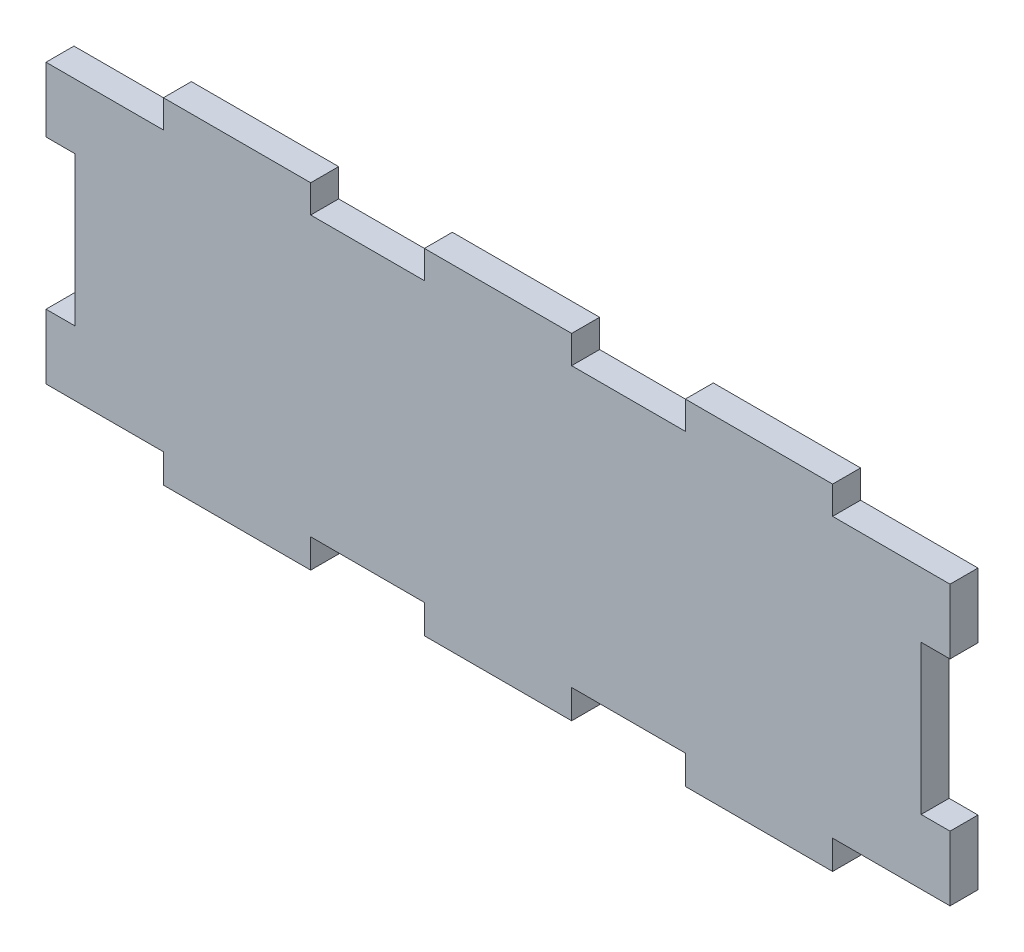
from build123d import *

# Parameters (mm, degrees)
BOSS_EXTRUDE1_DEPTH = 3


with BuildPart() as part:
    # Sketch1 → Boss-Extrude1 (new body)
    with BuildSketch(Plane.XY):
        Polygon((97, 22.95), (93.9, 22.95), (93.9, 6.95), (97, 6.95), (97, 0), (84.4, 0), (84.4, -3.1), (68.6, -3.1), (68.6, 0), (56.4, 0), (56.4, -3.1), (40.6, -3.1), (40.6, 0), (28.4, 0), (28.4, -3.1), (12.6, -3.1), (12.6, 0), (0, 0), (0, 6.95), (3.1, 6.95), (3.1, 22.95), (0, 22.95), (0, 29.9), (12.6, 29.9), (12.6, 32.9), (28.4, 32.9), (28.4, 29.9), (40.6, 29.9), (40.6, 32.9), (56.4, 32.9), (56.4, 29.9), (68.6, 29.9), (68.6, 32.9), (84.4, 32.9), (84.4, 29.9), (97, 29.9), align=None)
    extrude(amount=BOSS_EXTRUDE1_DEPTH)


solid = part.part
